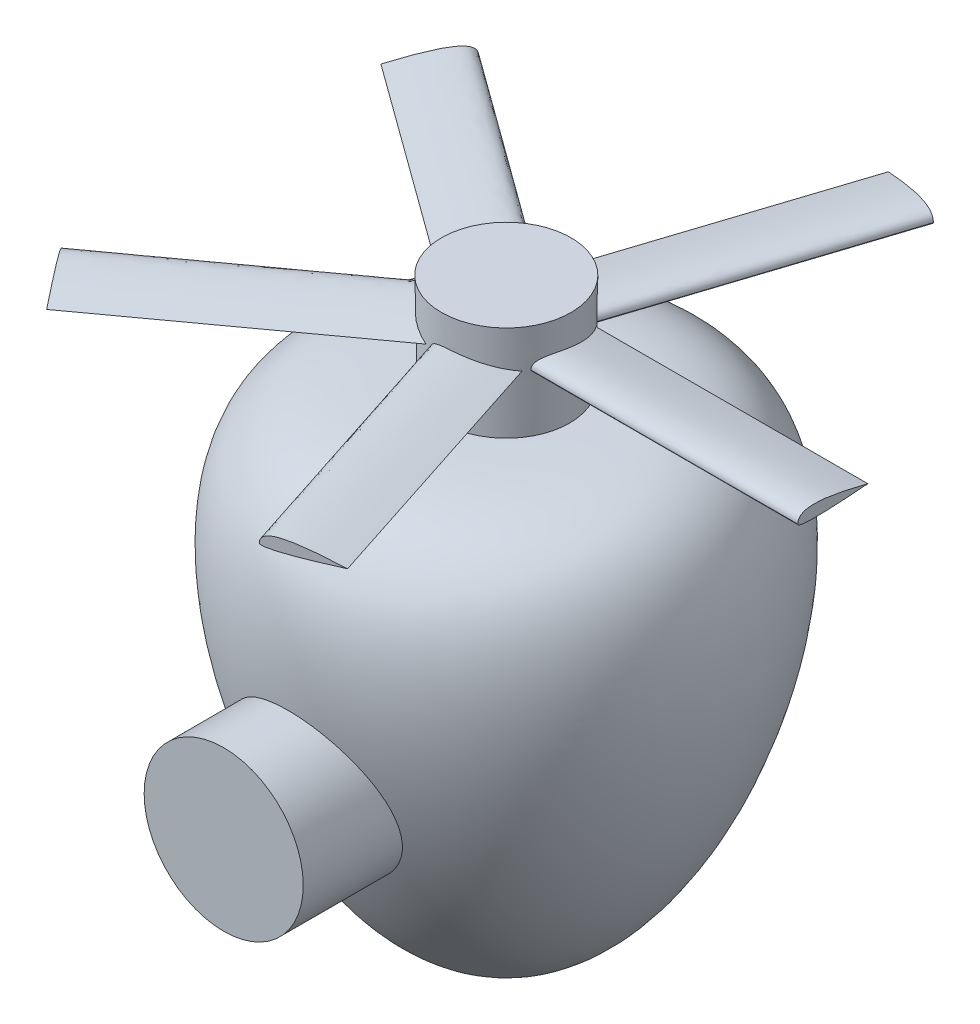
from build123d import *

# Parameters (mm, degrees)
BOSS_EXTRUDE1_DEPTH = 203.2
CIRPATTERN1_COUNT   = 5
SKETCH4_R           = 50.04416113
BOSS_EXTRUDE2_DEPTH = 177.8


with BuildPart() as part:
    # Sketch1 → Revolve1 (revolve)
    with BuildSketch(Plane.XY, mode=Mode.PRIVATE) as revolve1_sk:
        with BuildLine():
            Line((39.860812092, 304.8), (0, 264.939187908))
            Line((0, 264.939187908), (0, 0))
            add(Edge.make_bspline(
                [(39.860812092, 304.8), (137.726892847, 304.8), (184.847598395, 294.089865409), (127, 0), (0, 0)],
                knots=[0, 0, 0, 0, 0, 1, 1, 1, 1, 1], degree=4))
        make_face()
    revolve(revolve1_sk.sketch.rotate(Axis((0, 0, 0), (0, 1, 0)), 270), axis=Axis((0, 0, 0), (0, 1, 0)))

    # Sketch2 → Revolve2 (revolve)
    with BuildSketch(Plane(origin=(0, 0, 0), x_dir=(0, 0, -1), z_dir=(1, 0, 0)), mode=Mode.PRIVATE) as revolve2_sk:
        Polygon((39.860812092, 304.8), (40.752588079, 365.521147905), (0, 365.521147905), (0, 264.939187908), align=None)
    revolve(revolve2_sk.sketch.rotate(Axis((0, 365.521147905, 0), (0, -1, 0)), 180), axis=Axis((0, 365.521147905, 0), (0, -1, 0)))

    # Sketch3 → Boss-Extrude1 (add)
    with BuildSketch(Plane(origin=(0, 0, 0), x_dir=(0, 0, -1), z_dir=(1, 0, 0))):
        with BuildLine():
            add(Edge.make_bspline(
                [(-19.752889725, 341.315485371), (-19.752889725, 350.862201435), (0.408567961, 347.398038579), (24.292898678, 341.315485371)],
                knots=[0, 0, 0, 0, 1, 1, 1, 1], degree=3))
            add(Edge.make_bspline(
                [(-19.752889725, 341.315485371), (-19.752889725, 337.761786872), (24.292898678, 341.315485371)],
                knots=[0, 0, 0, 1, 1, 1], degree=2))
        make_face()
    boss_extrude1 = extrude(amount=BOSS_EXTRUDE1_DEPTH)

    # CirPattern1: Boss-Extrude1 ×5 about axis
    cirpattern1_axis = Axis((0, 365.521147905, 0), (0, 1, 0))
    for i in range(1, CIRPATTERN1_COUNT):
        add(boss_extrude1.rotate(cirpattern1_axis, i * 360 / CIRPATTERN1_COUNT))

    # Sketch4 → Boss-Extrude2 (add)
    with BuildSketch(Plane.XY):
        with Locations(Location((0, 146.909204575, 0), (0, 0, 180))):
            Circle(SKETCH4_R)
    extrude(amount=BOSS_EXTRUDE2_DEPTH)


solid = part.part
